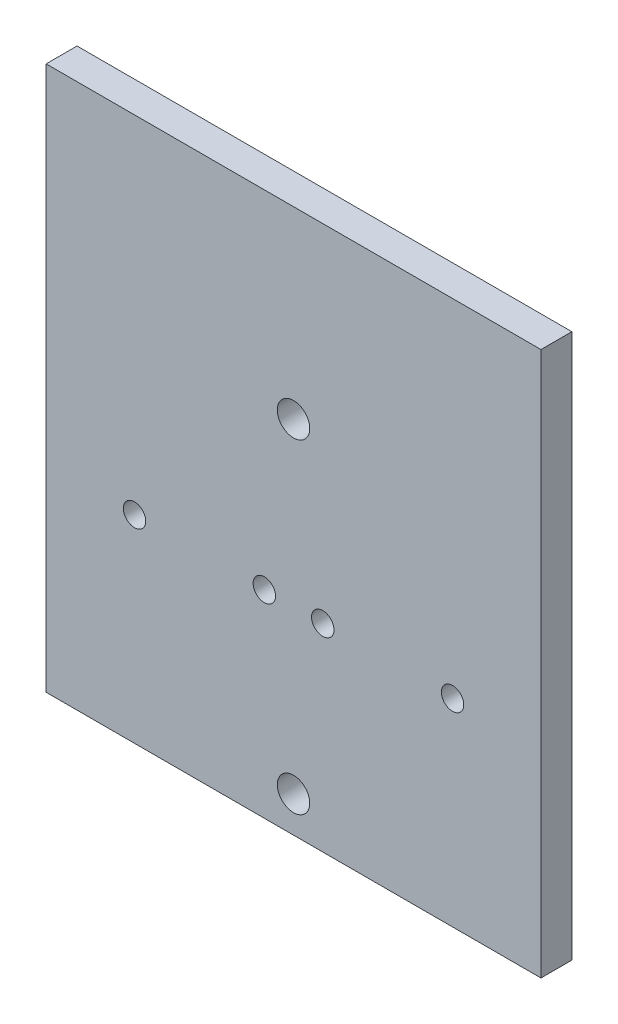
from build123d import *

# Parameters (mm, degrees)
SKETCH1_W           = 25.42
SKETCH1_H           = 25.42
BOSS_EXTRUDE5_DEPTH = 4.7625
SKETCH3_W           = 4.7625
SKETCH3_H           = 61
BOSS_EXTRUDE6_DEPTH = 7.62
SKETCH4_W           = 4.7625
SKETCH4_H           = 61
BOSS_EXTRUDE7_DEPTH = 7.62
SKETCH5_W           = 76.24
SKETCH5_H           = 4.7625
BOSS_EXTRUDE8_DEPTH = 22.86


with BuildPart() as part:
    # Sketch1 → Boss-Extrude5 (new body)
    with BuildSketch(Plane.XY):
        with BuildLine():
            Line((0, 27.5), (0, 30.5))
            Line((0, 30.5), (-5.08, 30.5))
            Line((-5.08, 30.5), (-5.08, 5.08))
            Line((-5.08, 5.08), (0, 5.08))
            Line((0, 5.08), (0, 22.5))
            ThreePointArc((0, 22.5), (-2.5, 25), (0, 27.5))
        make_face()
        with BuildLine():
            Line((5.08, 30.5), (0, 30.5))
            Line((0, 30.5), (0, 27.5))
            ThreePointArc((0, 27.5), (1.767766953, 26.767766953), (2.5, 25))
            ThreePointArc((2.5, 25), (1.767766953, 23.232233047), (0, 22.5))
            Line((0, 22.5), (0, 5.08))
            Line((0, 5.08), (5.08, 5.08))
            Line((5.08, 5.08), (5.08, 30.5))
        make_face()
        with BuildLine():
            Line((30.5, 5.08), (5.08, 5.08))
            Line((5.08, 5.08), (5.08, 1.626904988))
            ThreePointArc((5.08, 1.626904988), (5.911558685, 0.995350149), (6.2272, 0))
            Line((6.2272, 0), (22.7728, 0))
            ThreePointArc((22.7728, 0), (24.5, 1.7272), (26.2272, 0))
            Line((26.2272, 0), (30.5, 0))
            Line((30.5, 0), (30.5, 5.08))
        make_face()
        with BuildLine():
            Line((22.7728, 0), (6.2272, 0))
            ThreePointArc((6.2272, 0), (5.911558685, -0.995350149), (5.08, -1.626904988))
            Line((5.08, -1.626904988), (5.08, -5.08))
            Line((5.08, -5.08), (30.5, -5.08))
            Line((30.5, -5.08), (30.5, 0))
            Line((30.5, 0), (26.2272, 0))
            ThreePointArc((26.2272, 0), (24.5, -1.7272), (22.7728, 0))
        make_face()
        with BuildLine():
            Line((2.7728, 0), (0, 0))
            Line((0, 0), (0, -5.08))
            Line((0, -5.08), (5.08, -5.08))
            Line((5.08, -5.08), (5.08, -1.626904988))
            ThreePointArc((5.08, -1.626904988), (3.504649851, -1.411558685), (2.7728, 0))
        make_face()
        with BuildLine():
            Line((0, -5.08), (0, 0))
            Line((0, 0), (-2.7728, 0))
            ThreePointArc((-2.7728, 0), (-3.504649851, -1.411558685), (-5.08, -1.626904988))
            Line((-5.08, -1.626904988), (-5.08, -5.08))
            Line((-5.08, -5.08), (0, -5.08))
        make_face()
        with BuildLine():
            Line((5.08, 1.626904988), (5.08, 5.08))
            Line((5.08, 5.08), (0, 5.08))
            Line((0, 5.08), (0, 0))
            Line((0, 0), (2.7728, 0))
            ThreePointArc((2.7728, 0), (3.504649851, 1.411558685), (5.08, 1.626904988))
        make_face()
        with BuildLine():
            Line((0, 5.08), (-5.08, 5.08))
            Line((-5.08, 5.08), (-5.08, 1.626904988))
            ThreePointArc((-5.08, 1.626904988), (-3.504649851, 1.411558685), (-2.7728, 0))
            Line((-2.7728, 0), (0, 0))
            Line((0, 0), (0, 5.08))
        make_face()
        with BuildLine():
            Line((-5.08, 1.626904988), (-5.08, 5.08))
            Line((-5.08, 5.08), (-30.5, 5.08))
            Line((-30.5, 5.08), (-30.5, 0))
            Line((-30.5, 0), (-26.2272, 0))
            ThreePointArc((-26.2272, 0), (-24.5, 1.7272), (-22.7728, 0))
            Line((-22.7728, 0), (-6.2272, 0))
            ThreePointArc((-6.2272, 0), (-5.911558685, 0.995350149), (-5.08, 1.626904988))
        make_face()
        with BuildLine():
            ThreePointArc((-5.08, -1.626904988), (-5.911558685, -0.995350149), (-6.2272, 0))
            Line((-6.2272, 0), (-22.7728, 0))
            ThreePointArc((-22.7728, 0), (-24.5, -1.7272), (-26.2272, 0))
            Line((-26.2272, 0), (-30.5, 0))
            Line((-30.5, 0), (-30.5, -5.08))
            Line((-30.5, -5.08), (-5.08, -5.08))
            Line((-5.08, -5.08), (-5.08, -1.626904988))
        make_face()
        with BuildLine():
            Line((0, -22.5), (0, -5.08))
            Line((0, -5.08), (-5.08, -5.08))
            Line((-5.08, -5.08), (-5.08, -30.5))
            Line((-5.08, -30.5), (0, -30.5))
            Line((0, -30.5), (0, -27.5))
            ThreePointArc((0, -27.5), (-2.5, -25), (0, -22.5))
        make_face()
        with BuildLine():
            Line((5.08, -5.08), (0, -5.08))
            Line((0, -5.08), (0, -22.5))
            ThreePointArc((0, -22.5), (1.767766953, -23.232233047), (2.5, -25))
            ThreePointArc((2.5, -25), (1.767766953, -26.767766953), (0, -27.5))
            Line((0, -27.5), (0, -30.5))
            Line((0, -30.5), (5.08, -30.5))
            Line((5.08, -30.5), (5.08, -5.08))
        make_face()
        with Locations((-17.79, 17.79)):
            Rectangle(SKETCH1_W, SKETCH1_H)
        with Locations((17.79, 17.79)):
            Rectangle(SKETCH1_W, SKETCH1_H)
        with Locations((17.79, -17.79)):
            Rectangle(SKETCH1_W, SKETCH1_H)
        with Locations((-17.79, -17.79)):
            Rectangle(SKETCH1_W, SKETCH1_H)
    extrude(amount=BOSS_EXTRUDE5_DEPTH)

    # Sketch3 → Boss-Extrude6 (add)
    with BuildSketch(Plane.ZY.offset(30.5)):
        with Locations((2.38125, 0)):
            Rectangle(SKETCH3_W, SKETCH3_H)
    extrude(amount=BOSS_EXTRUDE6_DEPTH)

    # Sketch4 → Boss-Extrude7 (add)
    with BuildSketch(Plane(origin=(30.5, 0, 0), x_dir=(0, 0, -1), z_dir=(1, 0, 0))):
        with Locations((-2.38125, 0)):
            Rectangle(SKETCH4_W, SKETCH4_H)
    extrude(amount=BOSS_EXTRUDE7_DEPTH)

    # Sketch5 → Boss-Extrude8 (add)
    with BuildSketch(Plane(origin=(0, 30.5, 0), x_dir=(1, 0, 0), z_dir=(0, 1, 0))):
        with Locations((0, -2.38125)):
            Rectangle(SKETCH5_W, SKETCH5_H)
    extrude(amount=BOSS_EXTRUDE8_DEPTH)


solid = part.part
